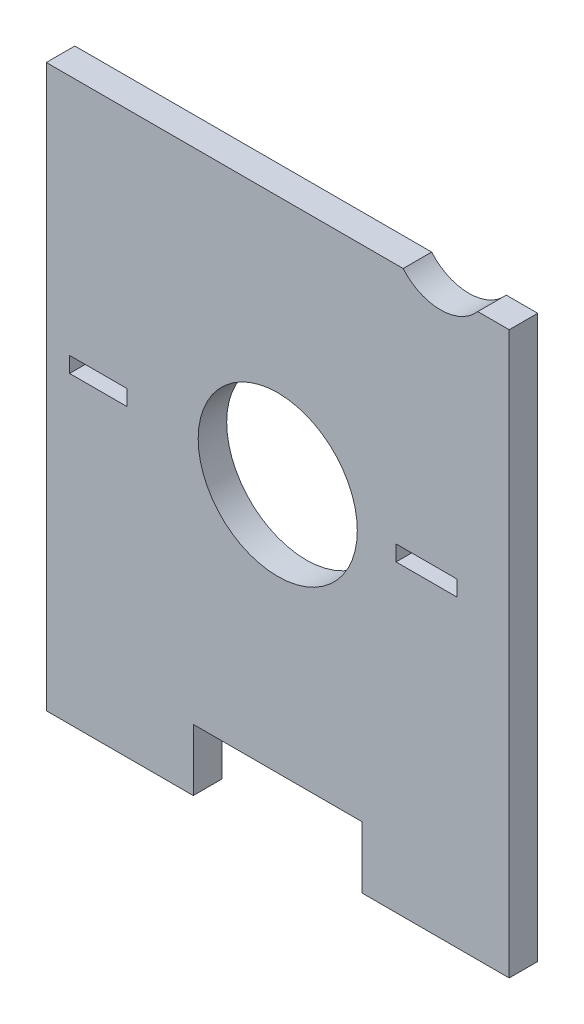
from build123d import *

# Parameters (mm, degrees)
SKETCH1_W          = 40
SKETCH1_H          = 43.18
BASE_DEPTH         = 2.4638
SKETCH2_W          = 12.7
SKETCH2_H          = 2.4638
BOTTOM_TABS_DEPTH  = 5.334
SKETCH3_R          = 6.875
SKETCH3_W          = 5.261651729
SKETCH3_H          = 1.351567934
SKETCH3_W_2        = 4.974619722
MOUNT_POINTS_DEPTH = 59.911651737
SKETCH4_R          = 4.245
CUT_EXTRUDE2_DEPTH = 36.250138525


with BuildPart() as part:
    # Sketch1 → Base (new body)
    with BuildSketch(Plane.XY):
        with Locations((20, 21.59)):
            Rectangle(SKETCH1_W, SKETCH1_H)
    extrude(amount=BASE_DEPTH)

    # Sketch2 → Bottom Tabs (add)
    with BuildSketch(Plane.XZ):
        with Locations((6.35, 1.2319)):
            Rectangle(SKETCH2_W, SKETCH2_H)
        with Locations((33.65, 1.2319)):
            Rectangle(SKETCH2_W, SKETCH2_H)
    extrude(amount=BOTTOM_TABS_DEPTH)

    # Sketch3 → Mount Points (cut, through all)
    with BuildSketch(Plane.XY.offset(2.4638)):
        with Locations((20, 21.59)):
            Circle(SKETCH3_R)
        with Locations((32.854435388, 21.59)):
            Rectangle(SKETCH3_W, SKETCH3_H)
        with Locations((4.5, 21.59)):
            Rectangle(SKETCH3_W_2, SKETCH3_H)
    extrude(amount=-MOUNT_POINTS_DEPTH, mode=Mode.SUBTRACT)

    # Sketch4 → Cut-Extrude2 (cut, through all)
    with BuildSketch(Plane(origin=(18.246403628, 22.293576812, 2.4638), x_dir=(1, 0, 0), z_dir=(0, 0, 1))):
        with Locations((15.813596372, 23.649057543)):
            Circle(SKETCH4_R)
    extrude(amount=-CUT_EXTRUDE2_DEPTH, mode=Mode.SUBTRACT)


solid = part.part
